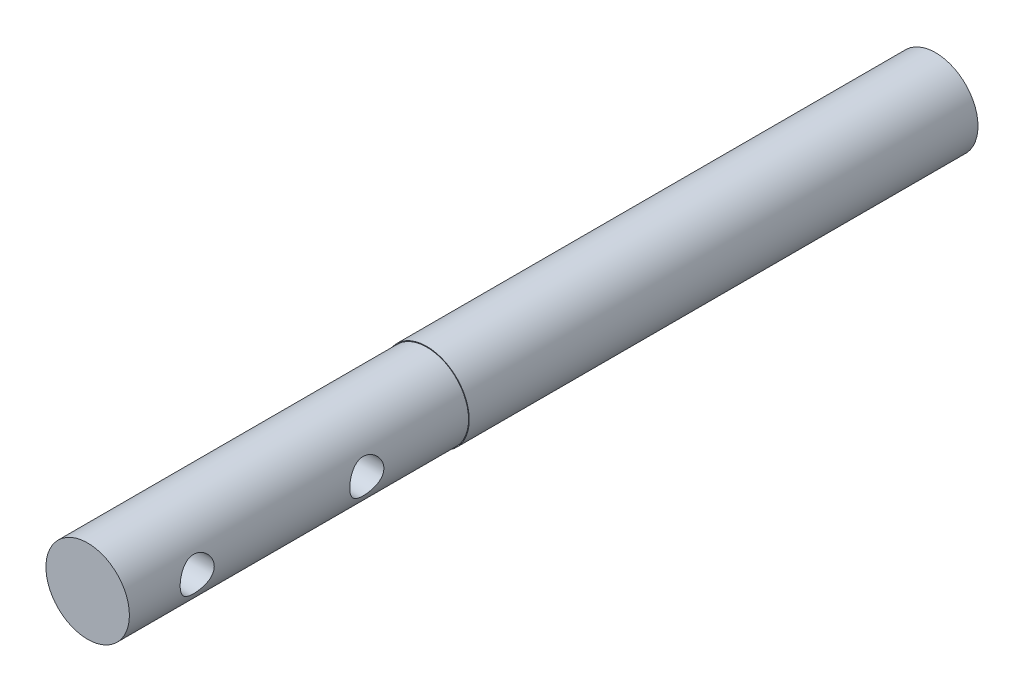
from build123d import *

# Parameters (mm, degrees)
SKETCH1_R               = 25
BOSS_EXTRUDE1_DEPTH     = 250
CUT_EXTRUDE1_DEPTH      = 253.487623459
CUT_EXTRUDE1_DEPTH_BACK = 253.487623459
SKETCH2_R               = 10.05
SKETCH3_OUTSIDE_W       = 152.996
SKETCH3_OUTSIDE_H       = 152.996
SKETCH3_OUTSIDE_R       = 24.61
CUT_EXTRUDE2_DEPTH      = 200


with BuildPart() as part:
    # Sketch1 → Boss-Extrude1 (new, symmetric)
    with BuildSketch(Plane.XY):
        Circle(SKETCH1_R)
    extrude(amount=BOSS_EXTRUDE1_DEPTH, both=True)

    # Sketch2 → Cut-Extrude1 (cut, two sides: drawn at the far end of the back side and taken through both)
    with BuildSketch(Plane(origin=(0, 0, 0), x_dir=(0, 0, -1), z_dir=(1, 0, 0)).offset(-CUT_EXTRUDE1_DEPTH_BACK)):
        with Locations(Location((-210, 0, 0), (0, 0, 180))):
            Circle(SKETCH2_R)
        with Locations(Location((-110, 0, 0), (0, 0, 180))):
            Circle(SKETCH2_R)
    extrude(amount=CUT_EXTRUDE1_DEPTH + CUT_EXTRUDE1_DEPTH_BACK, mode=Mode.SUBTRACT)

    # Sketch3 outside → Cut-Extrude2 (cut)
    with BuildSketch(Plane.XY.offset(250)):
        Rectangle(SKETCH3_OUTSIDE_W, SKETCH3_OUTSIDE_H)
        Circle(SKETCH3_OUTSIDE_R, mode=Mode.SUBTRACT)
    extrude(amount=-CUT_EXTRUDE2_DEPTH, mode=Mode.SUBTRACT)


solid = part.part
